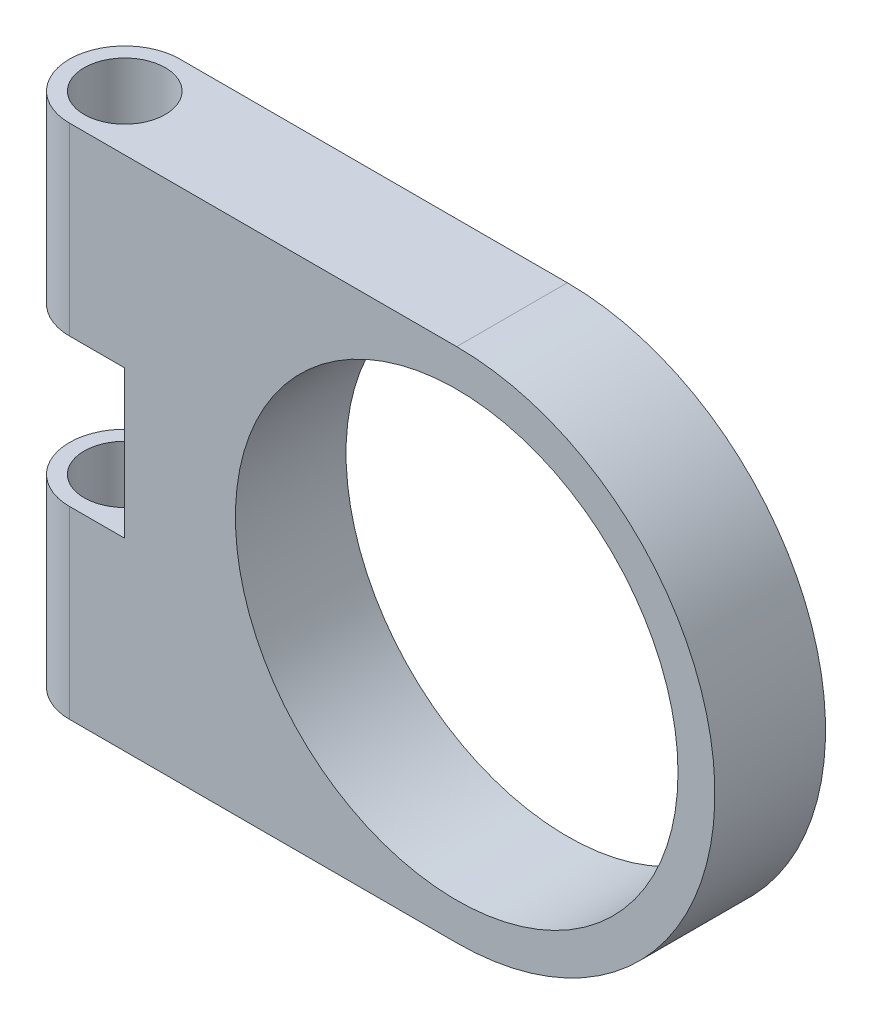
from build123d import *

# Parameters (mm, degrees)
PROFILE_SKETCH_R      = 30
PROFILE_EXTRUDE_DEPTH = 15
HOLE_SKETCH_R         = 5.5
HOLE_CUT_DEPTH        = 70
GAP_CUT_DEPTH         = 10
GAP_CUT_DEPTH_BACK    = 10
GAP_SKETCH_W          = 15
GAP_SKETCH_H          = 15
UPPER_FILLET_RADIUS   = 7.5
UPPER_FILLET_LENGTH   = 25
LOWER_FILLET_RADIUS   = 7.5
LOWER_FILLET_LENGTH   = 25


with BuildPart() as part:
    # Profile Sketch → Profile Extrude (new body)
    with BuildSketch(Plane.XY):
        with BuildLine():
            Line((-60, 35), (0, 35))
            ThreePointArc((0, 35), (35, 0), (0, -35))
            Line((0, -35), (-60, -35))
            Line((-60, -35), (-60, 35))
        make_face()
        Circle(PROFILE_SKETCH_R, mode=Mode.SUBTRACT)
    extrude(amount=-PROFILE_EXTRUDE_DEPTH)

    # Hole Sketch → Hole Cut (cut)
    with BuildSketch(Plane(origin=(0, 35, 0), x_dir=(1, 0, 0), z_dir=(0, 1, 0))):
        with Locations(Location((-52.5, 7.5, 0), (0, 0, 180))):
            Circle(HOLE_SKETCH_R)
    extrude(amount=-HOLE_CUT_DEPTH, mode=Mode.SUBTRACT)

    # Gap Sketch → Gap Cut (cut, two sides: drawn at the far end of the back side and taken through both)
    with BuildSketch(Plane(origin=(0, 0, 0), x_dir=(1, 0, 0), z_dir=(0, 1, 0)).offset(-GAP_CUT_DEPTH_BACK)):
        with Locations((-52.5, 7.5)):
            Rectangle(GAP_SKETCH_W, GAP_SKETCH_H)
    extrude(amount=GAP_CUT_DEPTH + GAP_CUT_DEPTH_BACK, mode=Mode.SUBTRACT)

    # Upper Fillet: full round fillet: the end face becomes a half cylinder, R = half its width
    upper_fillet_face = Plane((-60, 22.5, -7.5), x_dir=(0, -1, 0), z_dir=(-1, 0, 0))  # on the end face: x along it, z out of the body
    upper_fillet_slab = upper_fillet_face.offset(-UPPER_FILLET_RADIUS / 2) * Box(UPPER_FILLET_LENGTH, 2 * UPPER_FILLET_RADIUS, UPPER_FILLET_RADIUS, mode=Mode.PRIVATE)  # the body's end, R deep
    upper_fillet_round = Plane((-52.5, 22.5, -7.5), x_dir=(-1, 0, 0), z_dir=(0, -1, 0)) * Cylinder(UPPER_FILLET_RADIUS, UPPER_FILLET_LENGTH, mode=Mode.PRIVATE)  # its axis R under the face
    add(upper_fillet_slab - upper_fillet_round, mode=Mode.SUBTRACT)

    # Lower Fillet: full round fillet: the end face becomes a half cylinder, R = half its width
    lower_fillet_face = Plane((-60, -22.5, -7.5), x_dir=(0, 1, 0), z_dir=(-1, 0, 0))  # on the end face: x along it, z out of the body
    lower_fillet_slab = lower_fillet_face.offset(-LOWER_FILLET_RADIUS / 2) * Box(LOWER_FILLET_LENGTH, 2 * LOWER_FILLET_RADIUS, LOWER_FILLET_RADIUS, mode=Mode.PRIVATE)  # the body's end, R deep
    lower_fillet_round = Plane((-52.5, -22.5, -7.5), x_dir=(-1, 0, 0), z_dir=(0, 1, 0)) * Cylinder(LOWER_FILLET_RADIUS, LOWER_FILLET_LENGTH, mode=Mode.PRIVATE)  # its axis R under the face
    add(lower_fillet_slab - lower_fillet_round, mode=Mode.SUBTRACT)


solid = part.part
